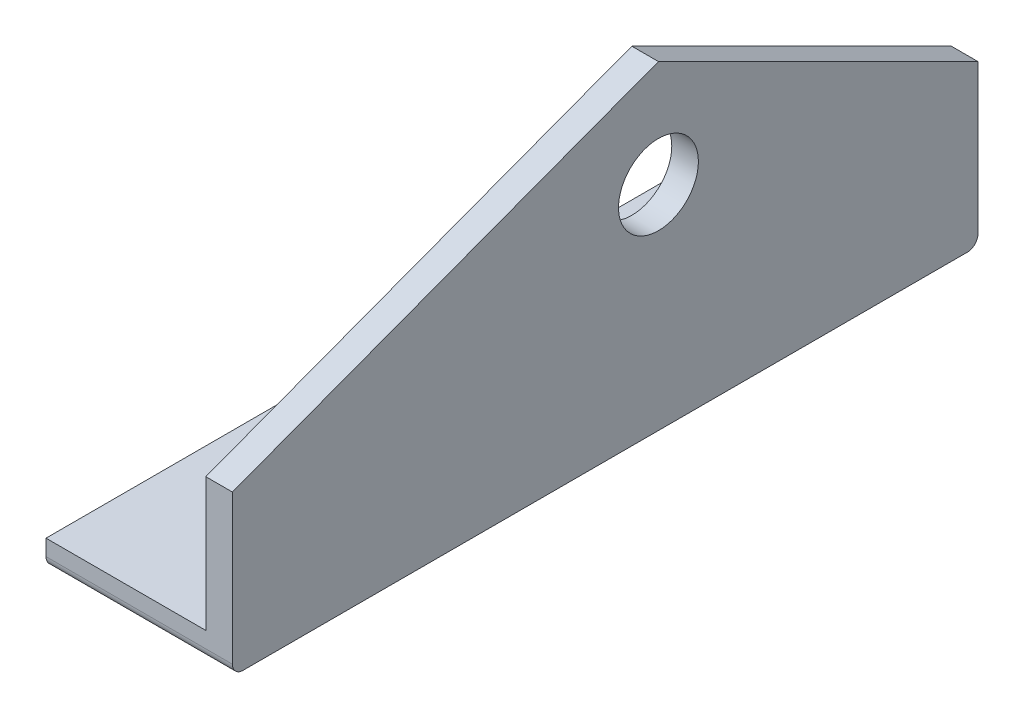
from build123d import *

# Parameters (mm, degrees)
SKETCH1_R           = 7.5
BOSS_EXTRUDE1_DEPTH = 5
SKETCH3_2_W         = 140
SKETCH3_2_H         = 5
BOSS_EXTRUDE3_DEPTH = 35
FILLET1_R           = 2


with BuildPart() as part:
    # Sketch1 → Boss-Extrude1 (new body)
    with BuildSketch(Plane(origin=(0, 0, 0), x_dir=(0, 0, -1), z_dir=(1, 0, 0))):
        Polygon((0, 20), (-80, -10), (-80, -40), (60, -40), (60, -10), align=None)
        Circle(SKETCH1_R, mode=Mode.SUBTRACT)
    extrude(amount=BOSS_EXTRUDE1_DEPTH)

    # Sketch3<2> → Boss-Extrude3 (add)
    with BuildSketch(Plane(origin=(5, 0, 0), x_dir=(0, 0, -1), z_dir=(1, 0, 0))):
        with Locations((-10, -37.5)):
            Rectangle(SKETCH3_2_W, SKETCH3_2_H)
    extrude(amount=-BOSS_EXTRUDE3_DEPTH)

    # Fillet1
    fillet1_edges = [part.edges().sort_by_distance(p)[0] for p in [
        (-12.5, -40, -60),
        (-12.5, -40, 80),
    ]]
    fillet(fillet1_edges, radius=FILLET1_R)


solid = part.part
